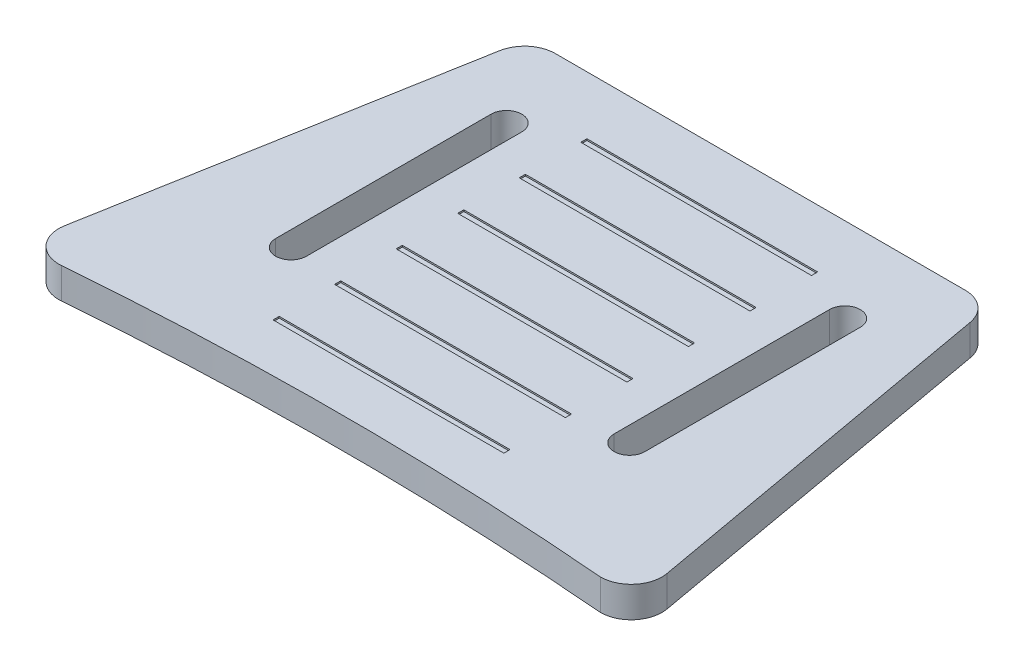
from build123d import *

# Parameters (mm, degrees)
RESSALTO_EXTRUS_O1_DEPTH = 2
ESBO_O2_W                = 15
ESBO_O2_H                = 0.4
CORTE_EXTRUS_O1_DEPTH    = 0.1
PADR_O_LINEAR1_COUNT     = 6
PADR_O_LINEAR1_PITCH     = 4


with BuildPart() as part:
    # Esboço1 → Ressalto-extrusão1 (new body)
    with BuildSketch(Plane(origin=(0, 0, 0), x_dir=(1, 0, 0), z_dir=(0, 1, 0))):
        with BuildLine():
            Line((1.674494665, 0), (28.325505335, 0))
            ThreePointArc((28.325505335, 0), (29.609412934, -0.466513359), (30.294360486, -1.648418723))
            Line((30.294360486, -1.648418723), (34.580074772, -25.648418723))
            ThreePointArc((34.580074772, -25.648418723), (34.144706262, -27.283907599), (32.611219621, -28))
            ThreePointArc((32.611219621, -28), (15.082885827, -27.269989968), (-2.446011347, -27.98634468))
            ThreePointArc((-2.446011347, -27.98634468), (-4.089503342, -27.338819548), (-4.578838652, -25.641496454))
            Line((-4.578838652, -25.641496454), (-0.294360486, -1.648418723))
            ThreePointArc((-0.294360486, -1.648418723), (0.390587066, -0.466513359), (1.674494665, 0))
        make_face()
        with BuildLine():
            Line((5, -5.5), (5, -19.5))
            ThreePointArc((5, -19.5), (4, -20.5), (3, -19.5))
            Line((3, -19.5), (3, -5.5))
            ThreePointArc((3, -5.5), (4, -4.5), (5, -5.5))
        make_face(mode=Mode.SUBTRACT)
        with BuildLine():
            Line((25, -5.5), (25, -19.5))
            ThreePointArc((25, -19.5), (26, -20.5), (27, -19.5))
            Line((27, -19.5), (27, -5.5))
            ThreePointArc((27, -5.5), (26, -4.5), (25, -5.5))
        make_face(mode=Mode.SUBTRACT)
    extrude(amount=RESSALTO_EXTRUS_O1_DEPTH)

    # Esboço2 → Corte-extrusão1 (cut)
    with BuildSketch(Plane(origin=(0, 2, 0), x_dir=(1, 0, 0), z_dir=(0, 1, 0))):
        with Locations((15, -23.969622092)):
            Rectangle(ESBO_O2_W, ESBO_O2_H)
    corte_extrus_o1 = extrude(amount=-CORTE_EXTRUS_O1_DEPTH, mode=Mode.SUBTRACT)

    # Padrão linear1: Corte-extrusão1 ×6
    with Locations(*[(0, 0, -i * PADR_O_LINEAR1_PITCH) for i in range(1, PADR_O_LINEAR1_COUNT)]):
        add(corte_extrus_o1, mode=Mode.SUBTRACT)


solid = part.part
